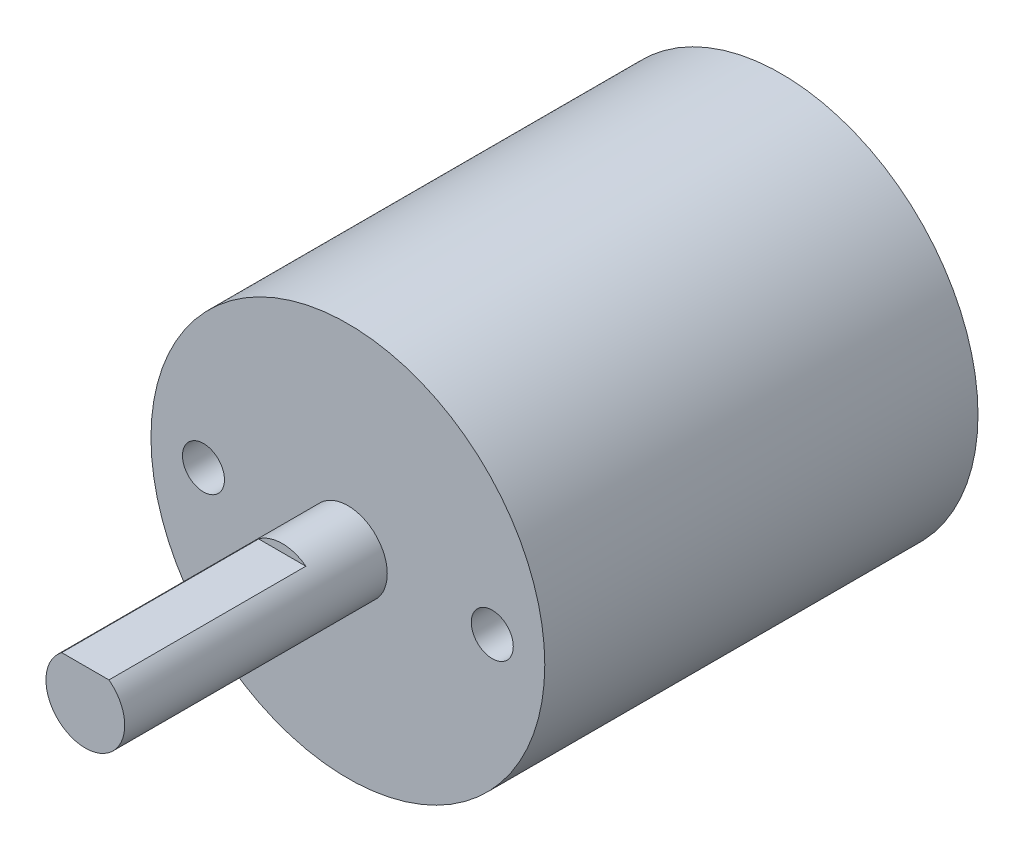
from build123d import *

# Parameters (mm, degrees)
SKETCH_1_R             = 7.5
EXTRUDE_1_DEPTH        = 16.5
SKETCH_2_R             = 1.5
EXTRUDE_2_DEPTH        = 10
SKETCH_3_W             = 3.798806197
SKETCH_3_H             = 0.511244187
CUT_EXTRUDE_1_DEPTH    = 7.5
HOLE_WIZARD_M2_1_D     = 1.6
HOLE_WIZARD_M2_1_DEPTH = 6
HOLE_WIZARD_M2_1_TIP   = 0.461880215


with BuildPart() as part:
    # 草图1 → 凸台-拉伸1 (new body)
    with BuildSketch(Plane.XY):
        Circle(SKETCH_1_R)
    extrude(amount=EXTRUDE_1_DEPTH)

    # 草图2 → 凸台-拉伸2 (add)
    with BuildSketch(Plane.XY.offset(16.5)):
        Circle(SKETCH_2_R)
    extrude(amount=EXTRUDE_2_DEPTH)

    # 草图3 → 切除-拉伸1 (cut)
    with BuildSketch(Plane.XY.offset(26.5)):
        with Locations((0.268189439, 1.455622094)):
            Rectangle(SKETCH_3_W, SKETCH_3_H)
    extrude(amount=-CUT_EXTRUDE_1_DEPTH, mode=Mode.SUBTRACT)

    # M2 螺纹孔1
    with Locations(Plane(origin=(5.5, 0, 16.5), x_dir=(1, 0, 0), z_dir=(0, 0, 1))):
        with Locations((0, 0), (-11, 0)):
            Hole(HOLE_WIZARD_M2_1_D / 2, depth=HOLE_WIZARD_M2_1_DEPTH)
            with Locations((0, 0, -(HOLE_WIZARD_M2_1_DEPTH + HOLE_WIZARD_M2_1_TIP / 2))):  # 120° drill point
                Cone(0, HOLE_WIZARD_M2_1_D / 2, HOLE_WIZARD_M2_1_TIP, mode=Mode.SUBTRACT)


solid = part.part
